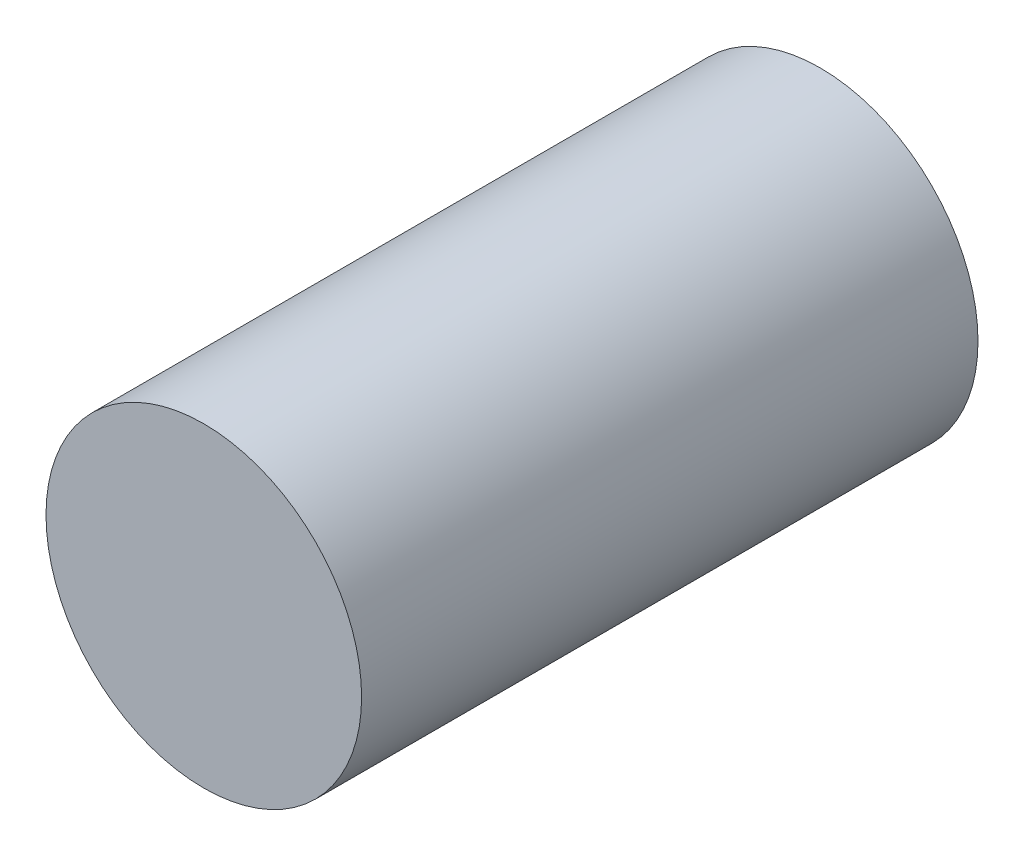
from build123d import *

# Parameters (mm, degrees)
SKETCH1_R           = 3.2
BOSS_EXTRUDE1_DEPTH = 12.5
SCALE_1_SCALE       = 2


with BuildPart() as part:
    # Sketch1 → Boss-Extrude1 (new body)
    with BuildSketch(Plane.XY):
        Circle(SKETCH1_R)
    extrude(amount=BOSS_EXTRUDE1_DEPTH)


with BuildPart() as part_1:
    # 缩放比例1: scaled about (0, 0, 6.25)
    add(part.part.scale(SCALE_1_SCALE).moved(Location((0, 0, -6.25))))


solid = part_1.part
